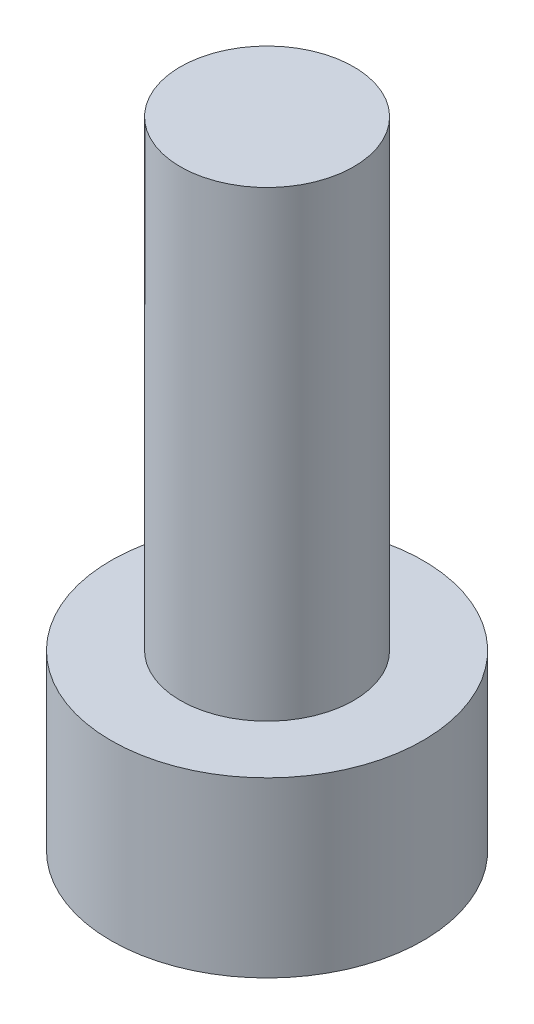
from build123d import *

# Parameters (mm, degrees)
SKETCH1_R           = 2.7
BOSS_EXTRUDE1_DEPTH = 3
SKETCH3_R           = 1.5
BOSS_EXTRUDE2_DEPTH = 8


with BuildPart() as part:
    # Sketch1 → Boss-Extrude1 (new body)
    with BuildSketch(Plane(origin=(0, 0, 0), x_dir=(1, 0, 0), z_dir=(0, 1, 0))):
        with Locations(Location((0, 0, 0), (0, 0, 270))):
            Circle(SKETCH1_R)
    extrude(amount=BOSS_EXTRUDE1_DEPTH)

    # Sketch3 → Boss-Extrude2 (add)
    with BuildSketch(Plane(origin=(0, 3, 0), x_dir=(1, 0, 0), z_dir=(0, 1, 0))):
        with Locations(Location((0, 0, 0), (0, 0, 270))):
            Circle(SKETCH3_R)
    extrude(amount=BOSS_EXTRUDE2_DEPTH)


solid = part.part
